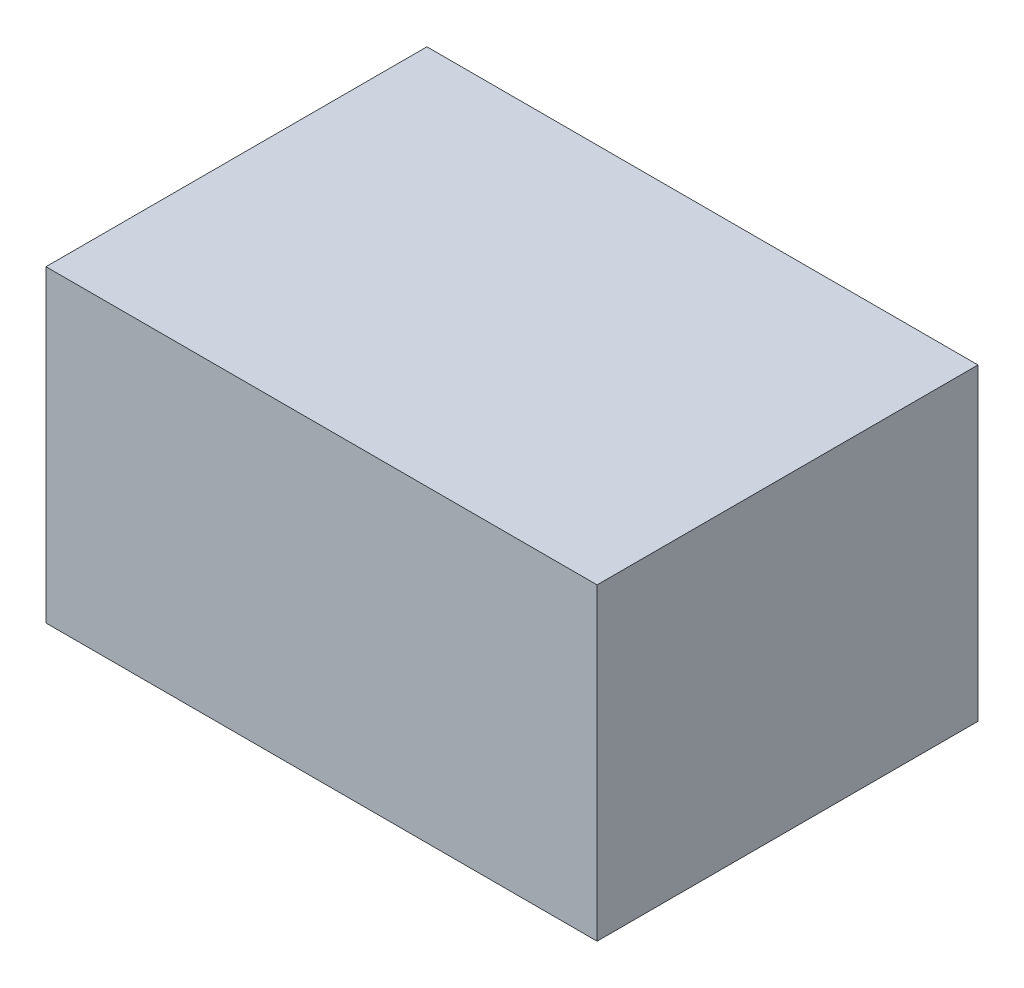
from build123d import *

# Parameters (mm, degrees)
SKETCH1_W               = 12.5
SKETCH1_H               = 7
COMPONENT_OUTLINE_DEPTH = 8.64


with BuildPart() as part:
    # Sketch1 → Component_Outline (new body)
    with BuildSketch(Plane.XY):
        with Locations((2.5, 1.25)):
            Rectangle(SKETCH1_W, SKETCH1_H)
    extrude(amount=COMPONENT_OUTLINE_DEPTH)


solid = part.part
